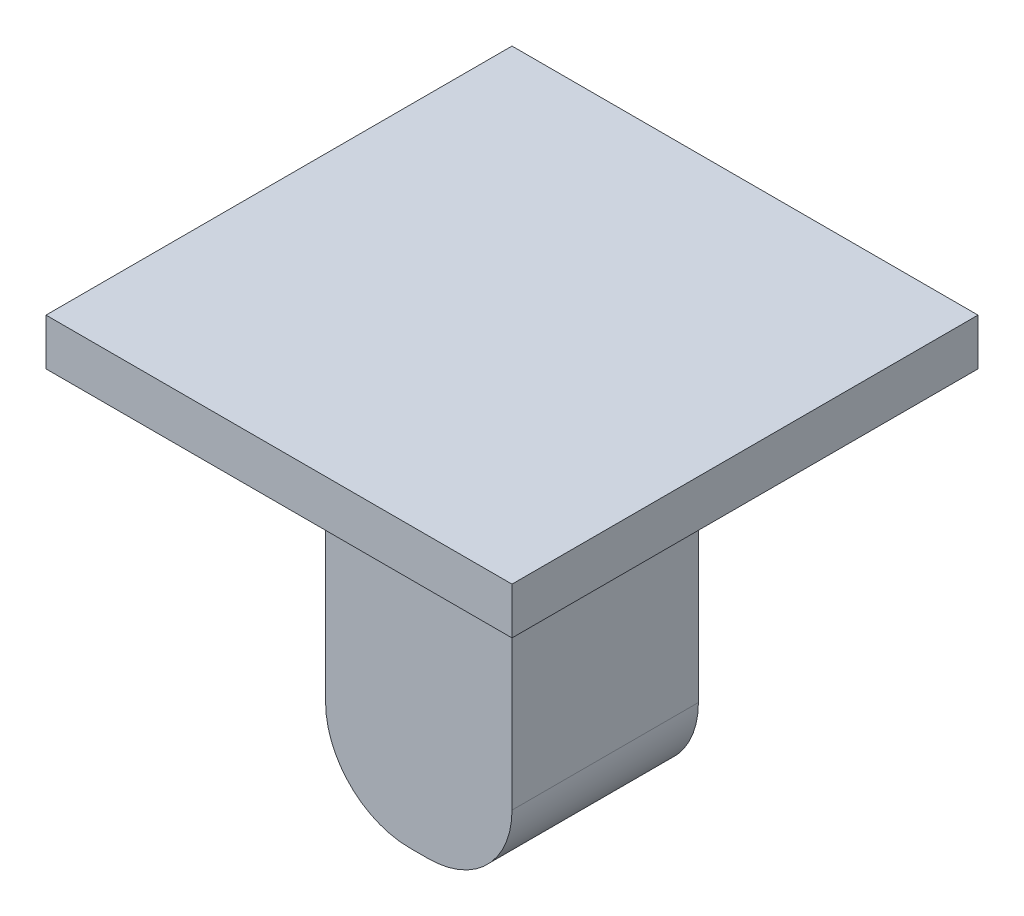
from build123d import *

# Parameters (mm, degrees)
RESSALTO_EXTRUS_O1_DEPTH = 20
ESBO_O2_W                = 50
ESBO_O2_H                = 50
RESSALTO_EXTRUS_O2_DEPTH = 5


with BuildPart() as part:
    # Esboço1 → Ressalto-extrusão1 (new body)
    with BuildSketch(Plane.XY):
        with BuildLine():
            Line((9, 0), (11, 0))
            ThreePointArc((11, 0), (17.363961031, 2.636038969), (20, 9))
            Line((20, 9), (20, 40))
            Line((20, 40), (0, 40))
            Line((0, 40), (0, 9))
            ThreePointArc((0, 9), (2.636038969, 2.636038969), (9, 0))
        make_face()
    extrude(amount=RESSALTO_EXTRUS_O1_DEPTH)

    # Esboço2 → Ressalto-extrusão2 (add)
    with BuildSketch(Plane(origin=(0, 40, 0), x_dir=(1, 0, 0), z_dir=(0, 1, 0))):
        with Locations((10, -10)):
            Rectangle(ESBO_O2_W, ESBO_O2_H)
    extrude(amount=RESSALTO_EXTRUS_O2_DEPTH)


solid = part.part
